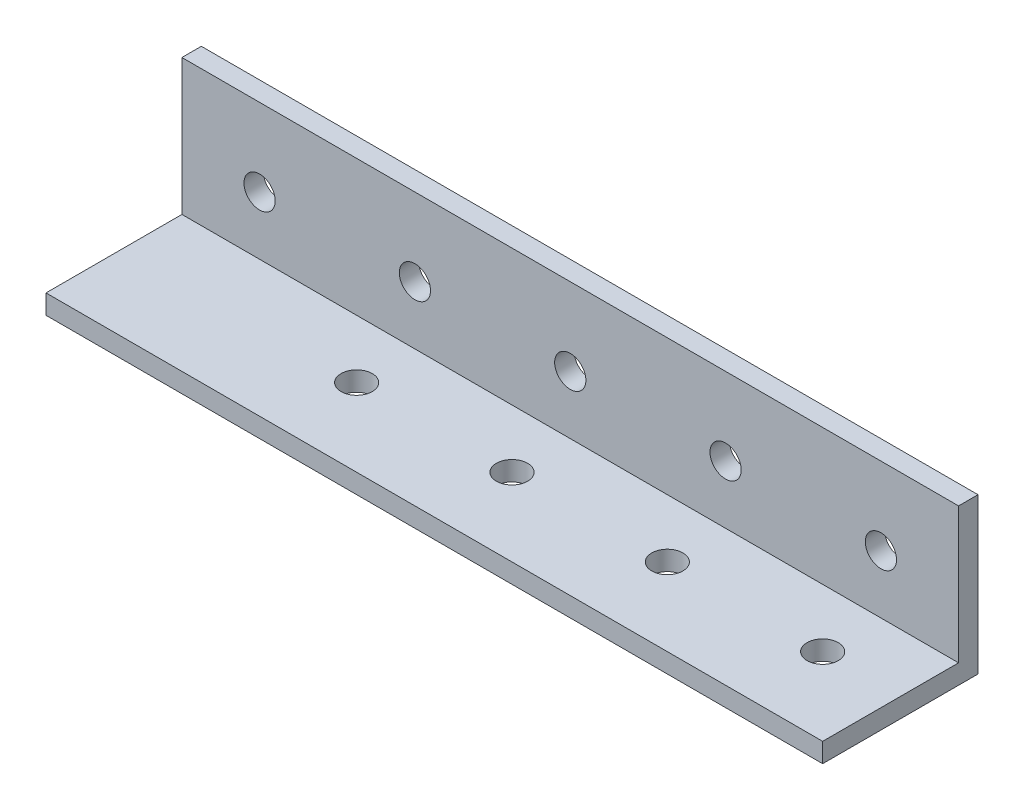
from build123d import *

# Parameters (mm, degrees)
SKETCH1_W                      = 127
SKETCH1_H                      = 25.4
BOSS_EXTRUDE1_DEPTH            = 25.4
SKETCH2_W                      = 22.225
SKETCH2_H                      = 22.225
CUT_EXTRUDE1_DEPTH             = 132.982271537
F_7_0_201_DIAMETER_HOLE1_D     = 5.1054
F_7_0_201_DIAMETER_HOLE1_DEPTH = 25.4
F_7_0_201_DIAMETER_HOLE2_D     = 5.1054


with BuildPart() as part:
    # Sketch1 → Boss-Extrude1 (new body)
    with BuildSketch(Plane(origin=(0, 25.4, 0), x_dir=(1, 0, 0), z_dir=(0, 1, 0))):
        with Locations((63.5, -12.7)):
            Rectangle(SKETCH1_W, SKETCH1_H)
    extrude(amount=-BOSS_EXTRUDE1_DEPTH)

    # Sketch2 → Cut-Extrude1 (cut, through all)
    with BuildSketch(Plane(origin=(127, 0, 0), x_dir=(0, 0, -1), z_dir=(1, 0, 0))):
        with Locations((-14.2875, 14.2875)):
            Rectangle(SKETCH2_W, SKETCH2_H)
    extrude(amount=-CUT_EXTRUDE1_DEPTH, mode=Mode.SUBTRACT)

    # #7 (0.201) Diameter Hole1
    with Locations(Plane.XZ):
        with Locations((-12.7, -12.7), (38.1, 12.7), (63.5, 12.7), (88.9, 12.7), (114.3, 12.7)):
            Hole(F_7_0_201_DIAMETER_HOLE1_D / 2, depth=F_7_0_201_DIAMETER_HOLE1_DEPTH)

    # #7 (0.201) Diameter Hole2 (through all)
    with Locations(Plane.XY.offset(3.175)):
        with Locations((12.7, 12.7), (38.1, 12.7), (63.5, 12.7), (88.9, 12.7), (114.3, 12.7)):
            Hole(F_7_0_201_DIAMETER_HOLE2_D / 2)


solid = part.part
